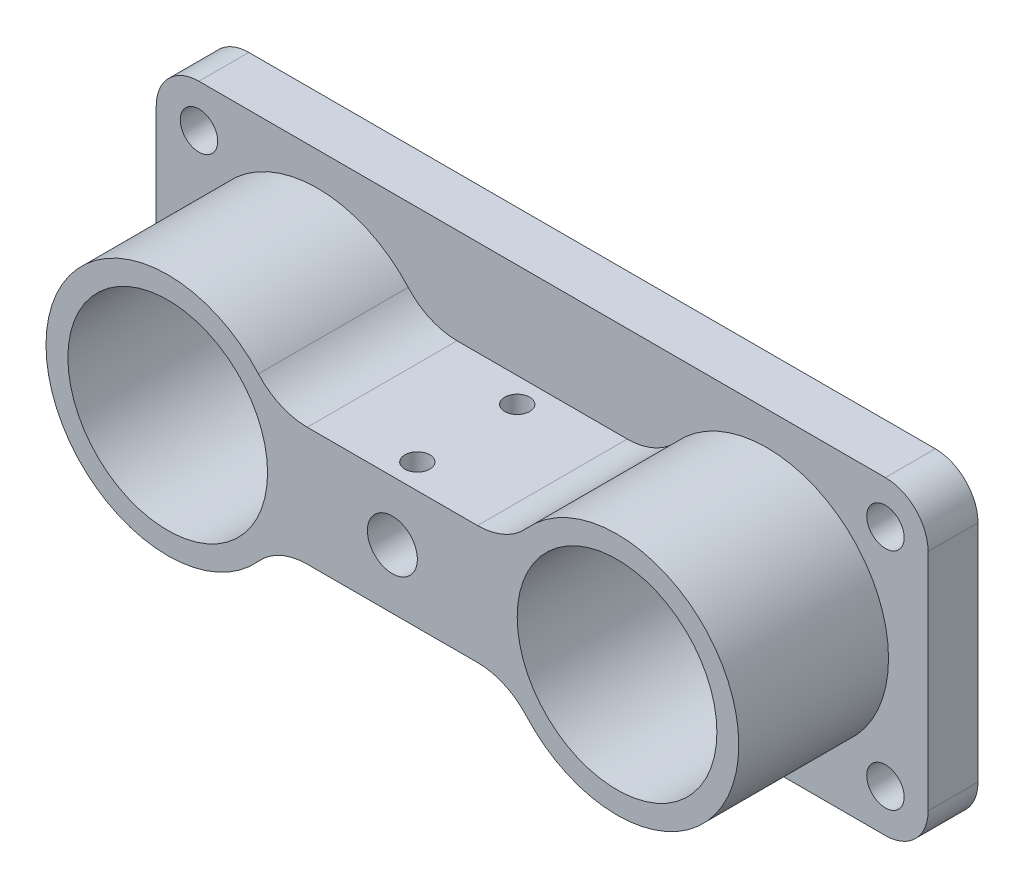
from build123d import *

# Parameters (mm, degrees)
BASE_EXTRUDE_DEPTH           = 50.8
BASE_EXTRUDE_DRAFT           = 3
SKETCH2_W                    = 245.218721479
SKETCH2_H                    = 134.011608982
CUT_EXTRUDE5_DEPTH           = 38.1
CUT_EXTRUDE5_DRAFT           = -5
SKETCH3_R                    = 24.60625
CUT_EXTRUDE1_DEPTH           = 123.388297682
CUT_EXTRUDE1_DRAFT           = -5
CUT_EXTRUDE1_PROFILE_2_DEPTH = 123.388297682
CUT_EXTRUDE1_PROFILE_2_DRAFT = -5
SKETCH5_W                    = 217.80183091
SKETCH5_H                    = 114.879329543
MILL_OUTSIDE_DEPTH           = 123.388297682
SKETCH9_W                    = 228.055799475
SKETCH9_H                    = 112.000717684
MILL_BOSS_DEPTH              = 38.1
SKETCH4_R                    = 25.4
SKETCH4_R_2                  = 6.35
SKETCH4_R_3                  = 4.7625
BORES_AND_HOLES_DEPTH        = 118.359218484
SKETCH18_R                   = 3.175
SET_SCREW_HOLES_DEPTH        = 38.1


with BuildPart() as part:
    # Sketch1 → Base-Extrude (with draft: the straight prism first)
    with BuildSketch(Plane.XY):
        with BuildLine():
            Line((99.7585, -28.575), (99.7585, 28.575))
            ThreePointArc((99.7585, 28.575), (96.113150999, 37.375650999), (87.3125, 41.021))
            Line((87.3125, 41.021), (-87.3125, 41.021))
            ThreePointArc((-87.3125, 41.021), (-96.113150999, 37.375650999), (-99.7585, 28.575))
            Line((-99.7585, 28.575), (-99.7585, -28.575))
            ThreePointArc((-99.7585, -28.575), (-96.113150999, -37.375650999), (-87.3125, -41.021))
            Line((-87.3125, -41.021), (87.3125, -41.021))
            ThreePointArc((87.3125, -41.021), (96.113150999, -37.375650999), (99.7585, -28.575))
        make_face()
    extrude(amount=-BASE_EXTRUDE_DEPTH)
    # Base-Extrude: the draft: its side faces are tilted about the plane it starts from
    base_extrude_sides = [part.faces().sort_by_distance(p)[0] for p in [
        (99.7585, 0, -25.4),
        (96.113150999, 37.375650999, -25.4),
        (0, 41.021, -25.4),
        (-96.113150999, 37.375650999, -25.4),
        (-99.7585, 0, -25.4),
        (-96.113150999, -37.375650999, -25.4),
        (0, -41.021, -25.4),
        (96.113150999, -37.375650999, -25.4),
    ]]
    draft(base_extrude_sides, Plane.XY, BASE_EXTRUDE_DRAFT)


with BuildPart() as cut_extrude5_tool:
    # Sketch2 → Cut-Extrude5 (with draft: the straight prism first)
    with BuildSketch(Plane.XY):
        with Locations((-2.312638736, -3.991522499)):
            Rectangle(SKETCH2_W, SKETCH2_H)
        with BuildLine():
            Line((-21.652420857, 19.05), (21.652420857, 19.05))
            ThreePointArc((21.652420857, 19.05), (26.837174146, 20.156539199), (31.118441962, 23.283333333))
            ThreePointArc((31.118441962, 23.283333333), (92.075, 0), (31.118441962, -23.283333333))
            ThreePointArc((31.118441962, -23.283333333), (26.837174146, -20.156539199), (21.652420857, -19.05))
            Line((21.652420857, -19.05), (-21.652420857, -19.05))
            ThreePointArc((-21.652420857, -19.05), (-26.837174146, -20.156539199), (-31.118441962, -23.283333333))
            ThreePointArc((-31.118441962, -23.283333333), (-92.075, 0), (-31.118441962, 23.283333333))
            ThreePointArc((-31.118441962, 23.283333333), (-26.837174146, 20.156539199), (-21.652420857, 19.05))
        make_face(mode=Mode.SUBTRACT)
    extrude(amount=-CUT_EXTRUDE5_DEPTH)
    # Cut-Extrude5: the draft: its side faces are tilted about the plane it starts from
    cut_extrude5_sides = [cut_extrude5_tool.faces().sort_by_distance(p)[0] for p in [
        (-124.921999475, -3.991522499, -19.05),
        (-2.312638735, -70.99732699, -19.05),
        (120.296722004, -3.991522499, -19.05),
        (-2.312638735, 63.014281992, -19.05),
        (-26.837174146, 20.156539199, -19.05),
        (0, 19.05, -19.05),
        (26.837174146, 20.156539199, -19.05),
        (92.075, 0, -19.05),
        (26.837174146, -20.156539199, -19.05),
        (0, -19.05, -19.05),
        (-26.837174146, -20.156539199, -19.05),
        (-92.075, 0, -19.05),
    ]]
    draft(cut_extrude5_sides, Plane.XY, CUT_EXTRUDE5_DRAFT)


with BuildPart() as part_1:
    add(part.part)

    # Cut-Extrude5: cut by cut_extrude5_tool
    add(cut_extrude5_tool.part, mode=Mode.SUBTRACT)


with BuildPart() as cut_extrude1_tool:
    # Sketch3 → Cut-Extrude1 (with draft: the straight prism first)
    with BuildSketch(Plane(origin=(0, 0, -50.8), x_dir=(-1, 0, 0), z_dir=(0, 0, -1))):
        with Locations((57.15, 0)):
            Circle(SKETCH3_R)
    extrude(amount=-CUT_EXTRUDE1_DEPTH)
    # Cut-Extrude1: the draft: its side faces are tilted about the plane it starts from
    cut_extrude1_sides = [cut_extrude1_tool.faces().sort_by_distance(p)[0] for p in [
        (-32.54375, 0, 10.894148841),
    ]]
    draft(cut_extrude1_sides, Plane(origin=(0, 0, -50.8), x_dir=(-1, 0, 0), z_dir=(0, 0, -1)), CUT_EXTRUDE1_DRAFT)


with BuildPart() as part_2:
    add(part_1.part)

    # Cut-Extrude1: cut by cut_extrude1_tool
    add(cut_extrude1_tool.part, mode=Mode.SUBTRACT)


with BuildPart() as cut_extrude1_profile_2_tool:
    # Sketch3 → Cut-Extrude1 profile 2 (with draft: the straight prism first)
    with BuildSketch(Plane(origin=(0, 0, -50.8), x_dir=(-1, 0, 0), z_dir=(0, 0, -1))):
        with Locations((-57.15, 0)):
            Circle(SKETCH3_R)
    extrude(amount=-CUT_EXTRUDE1_PROFILE_2_DEPTH)
    # Cut-Extrude1 profile 2: the draft: its side faces are tilted about the plane it starts from
    cut_extrude1_profile_2_sides = [cut_extrude1_profile_2_tool.faces().sort_by_distance(p)[0] for p in [
        (81.75625, 0, 10.894148841),
    ]]
    draft(cut_extrude1_profile_2_sides, Plane(origin=(0, 0, -50.8), x_dir=(-1, 0, 0), z_dir=(0, 0, -1)), CUT_EXTRUDE1_PROFILE_2_DRAFT)


with BuildPart() as part_3:
    add(part_2.part)

    # Cut-Extrude1 profile 2: cut by cut_extrude1_profile_2_tool
    add(cut_extrude1_profile_2_tool.part, mode=Mode.SUBTRACT)

    # Sketch5 → Mill outside (cut, through all)
    with BuildSketch(Plane.XY):
        with Locations((-0.351671417, -5.861190283)):
            Rectangle(SKETCH5_W, SKETCH5_H)
        with BuildLine():
            Line((98.171, -28.575), (98.171, 28.575))
            ThreePointArc((98.171, 28.575), (94.990618984, 36.253118984), (87.3125, 39.4335))
            Line((87.3125, 39.4335), (-87.3125, 39.4335))
            ThreePointArc((-87.3125, 39.4335), (-94.990618984, 36.253118984), (-98.171, 28.575))
            Line((-98.171, 28.575), (-98.171, -28.575))
            ThreePointArc((-98.171, -28.575), (-94.990618984, -36.253118984), (-87.3125, -39.4335))
            Line((-87.3125, -39.4335), (87.3125, -39.4335))
            ThreePointArc((87.3125, -39.4335), (94.990618984, -36.253118984), (98.171, -28.575))
        make_face(mode=Mode.SUBTRACT)
    extrude(amount=-MILL_OUTSIDE_DEPTH, mode=Mode.SUBTRACT)

    # Sketch9 → Mill boss (cut)
    with BuildSketch(Plane.XY):
        with Locations((8.711546203, 4.265795104)):
            Rectangle(SKETCH9_W, SKETCH9_H)
        with BuildLine():
            Line((-21.652420857, -15.0876), (21.652420857, -15.0876))
            ThreePointArc((21.652420857, -15.0876), (28.454817172, -16.53937943), (34.071840547, -20.641733333))
            ThreePointArc((34.071840547, -20.641733333), (88.1126, 0), (34.071840547, 20.641733333))
            ThreePointArc((34.071840547, 20.641733333), (28.454817172, 16.53937943), (21.652420857, 15.0876))
            Line((21.652420857, 15.0876), (-21.652420857, 15.0876))
            ThreePointArc((-21.652420857, 15.0876), (-28.454817172, 16.53937943), (-34.071840547, 20.641733333))
            ThreePointArc((-34.071840547, 20.641733333), (-88.1126, 0), (-34.071840547, -20.641733333))
            ThreePointArc((-34.071840547, -20.641733333), (-28.454817172, -16.53937943), (-21.652420857, -15.0876))
        make_face(mode=Mode.SUBTRACT)
    extrude(amount=-MILL_BOSS_DEPTH, mode=Mode.SUBTRACT)

    # Sketch4 → Bores and holes (cut, through all)
    with BuildSketch(Plane(origin=(0, 0, -50.8), x_dir=(-1, 0, 0), z_dir=(0, 0, -1))):
        with Locations((-57.15, 0)):
            Circle(SKETCH4_R)
        with Locations((57.15, 0)):
            Circle(SKETCH4_R)
        Circle(SKETCH4_R_2)
        with Locations((-87.3252, 28.575)):
            Circle(SKETCH4_R_3)
        with Locations((-87.3252, -28.575)):
            Circle(SKETCH4_R_3)
        with Locations((87.2998, -28.575)):
            Circle(SKETCH4_R_3)
        with Locations((87.2998, 28.575)):
            Circle(SKETCH4_R_3)
    extrude(amount=-BORES_AND_HOLES_DEPTH, mode=Mode.SUBTRACT)

    # Sketch18 → Set screw holes (cut)
    with BuildSketch(Plane(origin=(0, 0, 0), x_dir=(1, 0, 0), z_dir=(0, 1, 0))):
        with Locations(Location((0, 6.35, 0), (0, 0, 90))):
            Circle(SKETCH18_R)
        with Locations(Location((0, 31.75, 0), (0, 0, 90))):
            Circle(SKETCH18_R)
    extrude(amount=SET_SCREW_HOLES_DEPTH, mode=Mode.SUBTRACT)


solid = part_3.part
